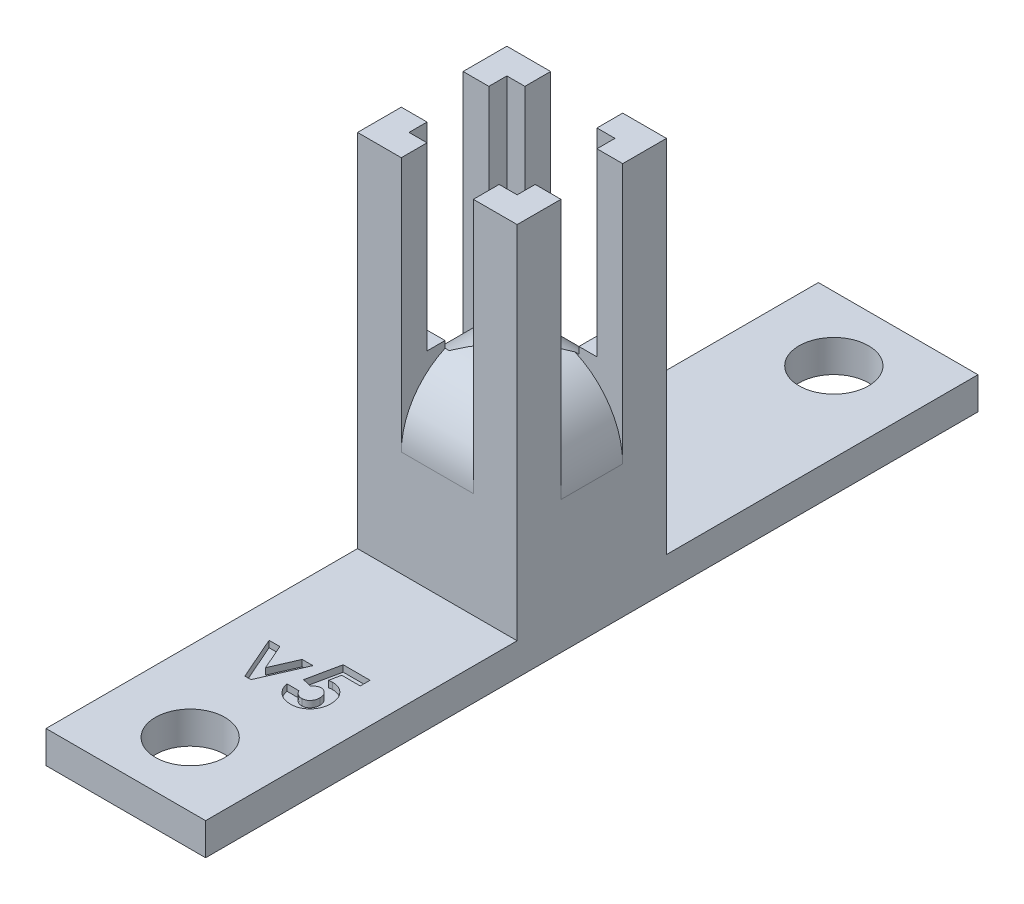
from build123d import *

# Parameters (mm, degrees)
BOSS_EXTRUDE1_DEPTH            = 17.78
BOSS_EXTRUDE1_2_DEPTH          = 17.78
BOSS_EXTRUDE1_3_DEPTH          = 17.78
BOSS_EXTRUDE1_4_DEPTH          = 17.78
SKETCH2_W                      = 15.748
SKETCH2_H                      = 14.732
BOSS_EXTRUDE2_DEPTH            = 17.78
SKETCH3_W                      = 15.748
SKETCH3_H                      = 76.2
SKETCH3_R                      = 3.429
BOSS_EXTRUDE3_DEPTH            = 3.175
CUT_EXTRUDE3_DEPTH             = 0.635
CUT_EXTRUDE4_REACH             = 46.19
CUT_EXTRUDE4_DIRECTION_2_REACH = 46.19
CUT_EXTRUDE5_REACH             = 46.19
CUT_EXTRUDE5_DIRECTION_2_REACH = 46.19


with BuildPart() as part:
    # Sketch1 → Boss-Extrude1 (new body)
    with BuildSketch(Plane(origin=(0, 0, 0), x_dir=(1, 0, 0), z_dir=(0, 1, 0))):
        Polygon((-5.334, 4.826), (-5.334, 3.048), (-7.874, 3.048), (-7.874, 7.366), (-3.556, 7.366), (-3.556, 4.826), align=None)
    extrude(amount=BOSS_EXTRUDE1_DEPTH)



with BuildPart() as body_2:
    # Sketch1 → Boss-Extrude1 2 (new body)
    with BuildSketch(Plane(origin=(0, 0, 0), x_dir=(1, 0, 0), z_dir=(0, 1, 0))):
        Polygon((7.874, 3.048), (7.874, 7.366), (3.556, 7.366), (3.556, 4.826), (5.334, 4.826), (5.334, 3.048), align=None)
    extrude(amount=BOSS_EXTRUDE1_2_DEPTH)


with BuildPart() as body_3:
    # Sketch1 → Boss-Extrude1 3 (new body)
    with BuildSketch(Plane(origin=(0, 0, 0), x_dir=(1, 0, 0), z_dir=(0, 1, 0))):
        Polygon((5.334, -3.048), (7.874, -3.048), (7.874, -7.366), (3.556, -7.366), (3.556, -4.826), (5.334, -4.826), align=None)
    extrude(amount=BOSS_EXTRUDE1_3_DEPTH)


with BuildPart() as body_4:
    # Sketch1 → Boss-Extrude1 4 (new body)
    with BuildSketch(Plane(origin=(0, 0, 0), x_dir=(1, 0, 0), z_dir=(0, 1, 0))):
        Polygon((-5.334, -3.048), (-7.874, -3.048), (-7.874, -7.366), (-3.556, -7.366), (-3.556, -4.826), (-5.334, -4.826), align=None)
    extrude(amount=BOSS_EXTRUDE1_4_DEPTH)


with BuildPart() as part_1:
    add(part.part)

    add(body_2.part)  # Boss-Extrude2 merges body 2

    add(body_3.part)  # Boss-Extrude2 merges body 3

    add(body_4.part)  # Boss-Extrude2 merges body 4
    # Sketch2 → Boss-Extrude2 (add)
    with BuildSketch(Plane(origin=(0, 0, 0), x_dir=(-1, 0, 0), z_dir=(0, -1, 0))):
        Rectangle(SKETCH2_W, SKETCH2_H)
    extrude(amount=BOSS_EXTRUDE2_DEPTH)

    # Sketch3 → Boss-Extrude3 (add)
    with BuildSketch(Plane(origin=(0, -17.78, 0), x_dir=(-1, 0, 0), z_dir=(0, -1, 0))):
        Rectangle(SKETCH3_W, SKETCH3_H)
        with Locations(Location((0, 31.75, 0), (0, 0, 90))):
            Circle(SKETCH3_R, mode=Mode.SUBTRACT)
        with Locations(Location((0, -31.75, 0), (0, 0, 270))):
            Circle(SKETCH3_R, mode=Mode.SUBTRACT)
    extrude(amount=BOSS_EXTRUDE3_DEPTH)

    # Sketch5 → Cut-Extrude3 (cut)
    with BuildSketch(Plane(origin=(0, -17.78, 0), x_dir=(1, 0, 0), z_dir=(0, 1, 0))):
        Polygon((-4.402938034, -19.56265828), (-3.33951656, -19.56265828), (-2.238782051, -22.073125862), (-1.138047543, -19.56265828), (-0.074626068, -19.56265828), (-1.937945713, -23.816344178), (-2.539618389, -23.816344178), align=None)
        with BuildLine():
            Line((1.342103198, -17.995510844), (3.992494658, -17.995510844))
            Line((3.992494658, -17.995510844), (3.992494658, -18.965649733))
            Line((3.992494658, -18.965649733), (2.169986144, -18.965649733))
            Line((2.169986144, -18.965649733), (1.942609842, -20.066384242))
            add(Edge.make_bspline(
                [(1.942609842, -20.066384242), (1.973593118, -20.057755008), (2.034698504, -20.040736387), (2.126753844, -20.023668863), (2.215968297, -20.012606236), (2.274510277, -20.011130629), (2.302913829, -20.01041469)],
                knots=[0, 0, 0, 0, 1.05461699, 2.079921384, 3.068411212, 4, 4, 4, 4], degree=3))
            add(Edge.make_bspline(
                [(2.302913829, -20.01041469), (2.364808143, -20.011832963), (2.486815471, -20.01462869), (2.66529671, -20.04116926), (2.83620304, -20.082969854), (2.999011469, -20.142586126), (3.153562954, -20.220178243), (3.300044843, -20.314042954), (3.438636917, -20.42434512), (3.566877199, -20.551153798), (3.684709726, -20.690392598), (3.787158388, -20.840994093), (3.874655939, -21.000810853), (3.944248465, -21.170836295), (3.99917682, -21.350002545), (4.038869276, -21.538424417), (4.062341408, -21.736325221), (4.065506481, -21.87133879), (4.067120726, -21.940198177)],
                knots=[0, 0, 0, 0, 1.01440847, 1.999622559, 2.951875003, 3.895578053, 4.836219714, 5.782137149, 6.743708247, 7.735272588, 8.734977101, 9.730283169, 10.717124674, 11.717316708, 12.737475749, 13.78628267, 14.87096371, 16, 16, 16, 16], degree=3))
            add(Edge.make_bspline(
                [(4.067120726, -21.940198177), (4.065148093, -22.009839278), (4.061255511, -22.147261527), (4.035859977, -22.349320843), (3.991036403, -22.542848052), (3.92946674, -22.728361222), (3.848352651, -22.904496875), (3.750801857, -23.073079646), (3.635165037, -23.232858198), (3.502576985, -23.382194608), (3.358436381, -23.518690953), (3.204960663, -23.63876705), (3.043228044, -23.739810112), (2.873234622, -23.821469989), (2.695955704, -23.88607783), (2.511337482, -23.933109254), (2.318482737, -23.960079163), (2.187559423, -23.963737055), (2.121012787, -23.965596314)],
                knots=[0, 0, 0, 0, 1.06808661, 2.107647099, 3.116961351, 4.110378221, 5.100014249, 6.085620622, 7.093190682, 8.119403071, 9.144090782, 10.133780668, 11.103064255, 12.062861538, 13.020824475, 13.992378307, 14.979551724, 16, 16, 16, 16], degree=3))
            add(Edge.make_bspline(
                [(2.121012787, -23.965596314), (2.061502111, -23.964075324), (1.944134605, -23.961075614), (1.77125742, -23.942637813), (1.604584616, -23.910039607), (1.445001044, -23.862861563), (1.290827618, -23.804796161), (1.143846625, -23.732174402), (1.003250382, -23.646379103), (0.869438127, -23.54897603), (0.744584119, -23.439255246), (0.630630611, -23.319146944), (0.526887714, -23.19016503), (0.435575361, -23.050718259), (0.356979792, -22.901012655), (0.287279637, -22.742812535), (0.230229362, -22.574465784), (0.201277991, -22.457758463), (0.186565171, -22.398448878)],
                knots=[0, 0, 0, 0, 1.054957082, 2.080596141, 3.077793124, 4.061112343, 5.027190972, 5.994718051, 6.962465889, 7.943658696, 8.924948258, 9.904494768, 10.875059, 11.855380583, 12.854004648, 13.869083016, 14.917087635, 16, 16, 16, 16], degree=3))
            Line((0.186565171, -22.398448878), (1.380582265, -22.398448878))
            add(Edge.make_bspline(
                [(1.380582265, -22.398448878), (1.402408926, -22.439548005), (1.444826552, -22.519419468), (1.525514253, -22.625460837), (1.615839012, -22.71588836), (1.71498605, -22.791585534), (1.823597778, -22.848296569), (1.937248474, -22.891303595), (2.057365883, -22.916155762), (2.139171142, -22.919262529), (2.180480435, -22.920831357)],
                knots=[0, 0, 0, 0, 1.104910296, 2.147267069, 3.153527244, 4.136738762, 5.099945312, 6.05603338, 7.018353, 8, 8, 8, 8], degree=3))
            add(Edge.make_bspline(
                [(2.180480435, -22.920831357), (2.209272459, -22.919748068), (2.265921249, -22.917616678), (2.349384285, -22.906341091), (2.429053419, -22.884985384), (2.505520973, -22.855412696), (2.578992357, -22.818532212), (2.648414335, -22.771973005), (2.714994724, -22.718381632), (2.777719899, -22.656885349), (2.834530829, -22.588331299), (2.884347799, -22.514665298), (2.928891041, -22.437524221), (2.961884902, -22.353852317), (2.988904083, -22.266148059), (3.008802101, -22.173749865), (3.020693411, -22.076549824), (3.021794228, -22.01019408), (3.022355769, -21.976345179)],
                knots=[0, 0, 0, 0, 0.978869489, 1.925942215, 2.855067702, 3.774946051, 4.70828698, 5.642468714, 6.60995405, 7.609372294, 8.622401667, 9.629904756, 10.629323, 11.642352373, 12.678539694, 13.745912462, 14.850161547, 16, 16, 16, 16], degree=3))
            add(Edge.make_bspline(
                [(3.022355769, -21.976345179), (3.021704036, -21.943281988), (3.020435422, -21.878923684), (3.009941194, -21.784422641), (2.99116722, -21.694758253), (2.965587521, -21.609243759), (2.932842452, -21.528398443), (2.892825789, -21.451741076), (2.845366576, -21.379659132), (2.790210015, -21.31362013), (2.731391627, -21.253047278), (2.668201777, -21.200070745), (2.601209774, -21.156103901), (2.532497311, -21.117719567), (2.459321633, -21.089784285), (2.383328169, -21.070546287), (2.304596835, -21.056430218), (2.250895901, -21.055600847), (2.223623631, -21.055179648)],
                knots=[0, 0, 0, 0, 1.166249705, 2.270133367, 3.348514167, 4.393962215, 5.415026464, 6.420877785, 7.440098956, 8.453121383, 9.451844239, 10.415694839, 11.355045125, 12.27538808, 13.187007209, 14.108269027, 15.039275622, 16, 16, 16, 16], degree=3))
            add(Edge.make_bspline(
                [(2.223623631, -21.055179648), (2.193999608, -21.056303715), (2.13462671, -21.058556587), (2.046413445, -21.076887601), (1.959263786, -21.106554059), (1.872693092, -21.14748364), (1.787560727, -21.201047546), (1.701620007, -21.263871867), (1.617747551, -21.340521386), (1.56441911, -21.397610121), (1.536830596, -21.427143957)],
                knots=[0, 0, 0, 0, 0.88288272, 1.769486374, 2.674910571, 3.623812639, 4.617874466, 5.670434592, 6.794841017, 8, 8, 8, 8], degree=3))
            Line((1.536830596, -21.427143957), (0.657642228, -21.225420366))
            Line((0.657642228, -21.225420366), (1.342103198, -17.995510844))
        make_face()
    extrude(amount=-CUT_EXTRUDE3_DEPTH, mode=Mode.SUBTRACT)

    # Cut-Extrude4: up to this face of the body (flat: up to its plane)
    cut_extrude4_end = Plane(part_1.part.faces().sort_by_distance((-3.556, 8.89, 6.096))[0])
    # Sketch6 → Cut-Extrude4 (cut, up to the picked face)
    with BuildSketch(Plane(origin=(0, 0, 0), x_dir=(0, 0, -1), z_dir=(1, 0, 0)), mode=Mode.PRIVATE) as cut_extrude4_sk1:
        with BuildLine():
            Line((-7.366, -7.366), (-7.366, 2.54))
            Line((-7.366, 2.54), (7.366, 2.54))
            Line((7.366, 2.54), (7.366, -7.366))
            ThreePointArc((7.366, -7.366), (0, 0), (-7.366, -7.366))
        make_face()
    cut_extrude4_tool1 = split(extrude(cut_extrude4_sk1.sketch, amount=-CUT_EXTRUDE4_REACH, mode=Mode.PRIVATE), bisect_by=cut_extrude4_end, keep=Keep.BOTH, mode=Mode.PRIVATE)
    add(cut_extrude4_tool1.solids().sort_by(Axis((0, 0.151656, 0), (-1, 0, 0)))[0], mode=Mode.SUBTRACT)

    # Cut-Extrude4 direction 2: up to this face of the body (flat: up to its plane)
    cut_extrude4_direction_2_end = Plane(part_1.part.faces().sort_by_distance((3.556, 8.89, 6.096))[0])
    # Sketch6 → Cut-Extrude4 direction 2 (cut, up to the picked face)
    with BuildSketch(Plane(origin=(0, 0, 0), x_dir=(0, 0, -1), z_dir=(1, 0, 0)), mode=Mode.PRIVATE) as cut_extrude4_direction_2_sk1:
        with BuildLine():
            Line((-7.366, -7.366), (-7.366, 2.54))
            Line((-7.366, 2.54), (7.366, 2.54))
            Line((7.366, 2.54), (7.366, -7.366))
            ThreePointArc((7.366, -7.366), (0, 0), (-7.366, -7.366))
        make_face()
    cut_extrude4_direction_2_tool1 = split(extrude(cut_extrude4_direction_2_sk1.sketch, amount=CUT_EXTRUDE4_DIRECTION_2_REACH, mode=Mode.PRIVATE), bisect_by=cut_extrude4_direction_2_end, keep=Keep.BOTH, mode=Mode.PRIVATE)
    add(cut_extrude4_direction_2_tool1.solids().sort_by(Axis((0, 0.151656, 0), (1, 0, 0)))[0], mode=Mode.SUBTRACT)

    # Cut-Extrude5: up to this face of the body (flat: up to its plane)
    cut_extrude5_end = Plane(part_1.part.faces().sort_by_distance((-6.604, 8.89, -3.048))[0])
    # Sketch7 → Cut-Extrude5 (cut, up to the picked face)
    with BuildSketch(Plane.XY, mode=Mode.PRIVATE) as cut_extrude5_sk1:
        with BuildLine():
            Line((-7.874, -7.874), (-7.874, 4.538671937))
            Line((-7.874, 4.538671937), (7.874, 4.538671937))
            Line((7.874, 4.538671937), (7.874, -7.874))
            ThreePointArc((7.874, -7.874), (0, 0), (-7.874, -7.874))
        make_face()
    cut_extrude5_tool1 = split(extrude(cut_extrude5_sk1.sketch, amount=-CUT_EXTRUDE5_REACH, mode=Mode.PRIVATE), bisect_by=cut_extrude5_end, keep=Keep.BOTH, mode=Mode.PRIVATE)
    add(cut_extrude5_tool1.solids().sort_by(Axis((0, 1.176505, 0), (0, 0, -1)))[0], mode=Mode.SUBTRACT)

    # Cut-Extrude5 direction 2: up to this face of the body (flat: up to its plane)
    cut_extrude5_direction_2_end = Plane(part_1.part.faces().sort_by_distance((-6.604, 8.89, 3.048))[0])
    # Sketch7 → Cut-Extrude5 direction 2 (cut, up to the picked face)
    with BuildSketch(Plane.XY, mode=Mode.PRIVATE) as cut_extrude5_direction_2_sk1:
        with BuildLine():
            Line((-7.874, -7.874), (-7.874, 4.538671937))
            Line((-7.874, 4.538671937), (7.874, 4.538671937))
            Line((7.874, 4.538671937), (7.874, -7.874))
            ThreePointArc((7.874, -7.874), (0, 0), (-7.874, -7.874))
        make_face()
    cut_extrude5_direction_2_tool1 = split(extrude(cut_extrude5_direction_2_sk1.sketch, amount=CUT_EXTRUDE5_DIRECTION_2_REACH, mode=Mode.PRIVATE), bisect_by=cut_extrude5_direction_2_end, keep=Keep.BOTH, mode=Mode.PRIVATE)
    add(cut_extrude5_direction_2_tool1.solids().sort_by(Axis((0, 1.176505, 0), (0, 0, 1)))[0], mode=Mode.SUBTRACT)


solid = part_1.part
